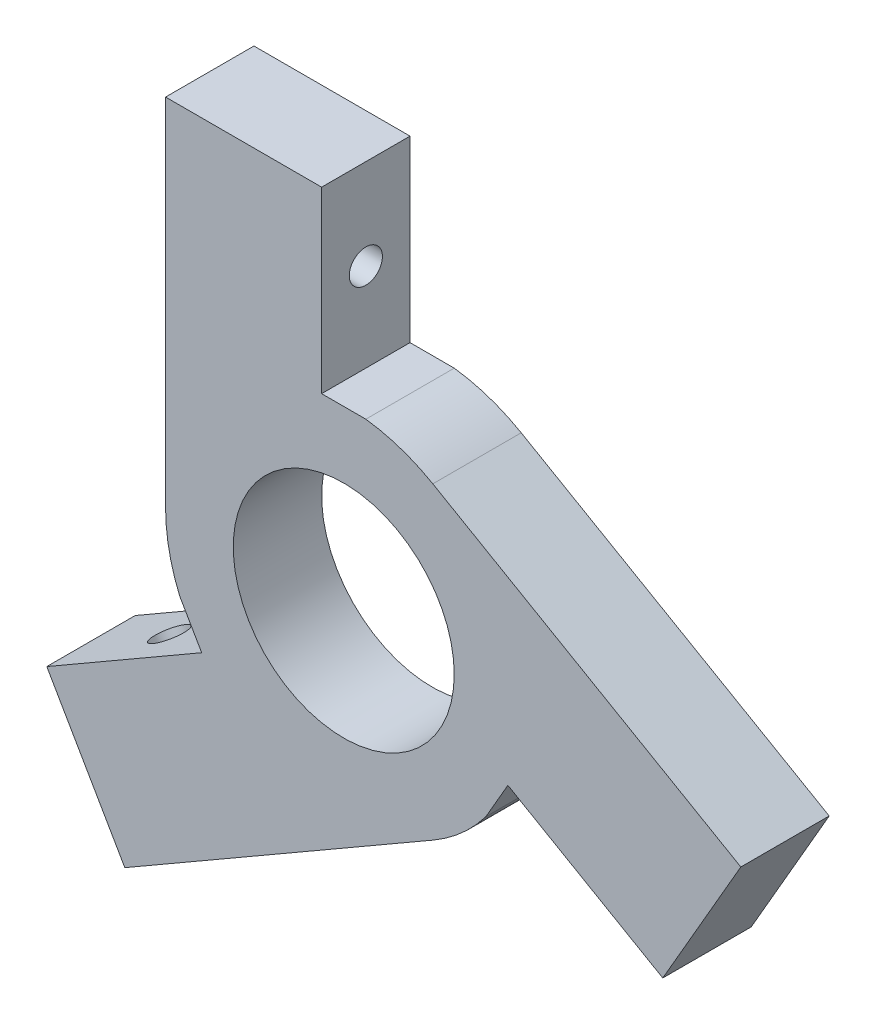
from build123d import *

# Parameters (mm, degrees)
SKETCH1_R           = 31.75
BOSS_EXTRUDE1_DEPTH = 12.7
SKETCH2_R           = 4.7625
CUT_EXTRUDE1_DEPTH  = 25.4
CIRPATTERN1_COUNT   = 3


with BuildPart() as part:
    # Sketch1 → Boss-Extrude1 (new, symmetric)
    with BuildSketch(Plane.XY):
        with BuildLine():
            Line((-51.195336702, 0), (-51.195336702, 102.193578565))
            Line((-51.195336702, 102.193578565), (-6.35, 102.193578565))
            Line((-6.35, 102.193578565), (-6.35, 50.8))
            Line((-6.35, 50.8), (6.35, 50.8))
            ThreePointArc((6.35, 50.8), (16.297475531, 48.531997603), (25.597668351, 44.336462139))
            Line((25.597668351, 44.336462139), (114.099903492, -6.760327144))
            Line((114.099903492, -6.760327144), (91.677235141, -45.597527969))
            Line((91.677235141, -45.597527969), (47.169090512, -19.900738686))
            Line((47.169090512, -19.900738686), (40.819090512, -30.899261314))
            ThreePointArc((40.819090512, -30.899261314), (33.881205055, -38.380026629), (25.597668351, -44.336462139))
            Line((25.597668351, -44.336462139), (-62.90456679, -95.433251422))
            Line((-62.90456679, -95.433251422), (-85.327235141, -56.596050597))
            Line((-85.327235141, -56.596050597), (-40.819090512, -30.899261314))
            Line((-40.819090512, -30.899261314), (-47.169090512, -19.900738686))
            ThreePointArc((-47.169090512, -19.900738686), (-50.178680586, -10.151970974), (-51.195336702, 0))
        make_face()
        Circle(SKETCH1_R, mode=Mode.SUBTRACT)
    extrude(amount=BOSS_EXTRUDE1_DEPTH, both=True)

    # Sketch2 → Cut-Extrude1 (cut)
    with BuildSketch(Plane(origin=(-6.35, 0, 0), x_dir=(0, 0, -1), z_dir=(1, 0, 0))):
        with Locations(Location((0, 76.2, 0), (0, 0, 90))):
            Circle(SKETCH2_R)
    cut_extrude1 = extrude(amount=-CUT_EXTRUDE1_DEPTH, mode=Mode.SUBTRACT)

    # CirPattern1: Cut-Extrude1 ×3 about axis
    cirpattern1_axis = Axis((0, 0, 0), (0, 0, 1))
    for i in range(1, CIRPATTERN1_COUNT):
        add(cut_extrude1.rotate(cirpattern1_axis, i * 360 / CIRPATTERN1_COUNT), mode=Mode.SUBTRACT)


solid = part.part
